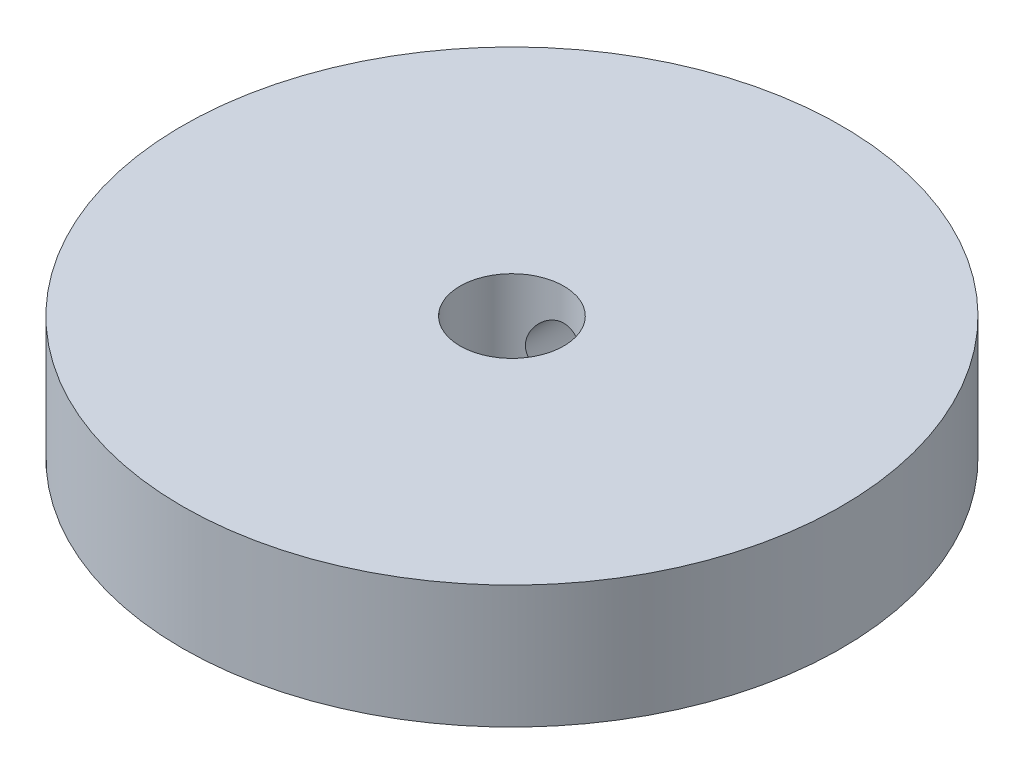
from build123d import *

# Parameters (mm, degrees)
SKETCH1_R           = 13.3985
SKETCH1_R_2         = 2.11
BOSS_EXTRUDE1_DEPTH = 2.5
SKETCH2_R           = 1.192853847
CUT_EXTRUDE1_DEPTH  = 20.112550968


with BuildPart() as part:
    # Sketch1 → Boss-Extrude1 (new, symmetric)
    with BuildSketch(Plane(origin=(0, 0, 0), x_dir=(1, 0, 0), z_dir=(0, 1, 0))):
        with Locations(Location((0, 0, 0), (0, 0, 270))):
            Circle(SKETCH1_R)
        with Locations(Location((0, 0, 0), (0, 0, 270))):
            Circle(SKETCH1_R_2, mode=Mode.SUBTRACT)
    extrude(amount=BOSS_EXTRUDE1_DEPTH, both=True)

    # Sketch2 → Cut-Extrude1 (cut, through all)
    with BuildSketch(Plane.XY):
        with Locations(Location((0, 0, 0), (0, 0, 90))):
            Circle(SKETCH2_R)
    extrude(amount=-CUT_EXTRUDE1_DEPTH, mode=Mode.SUBTRACT)


solid = part.part
